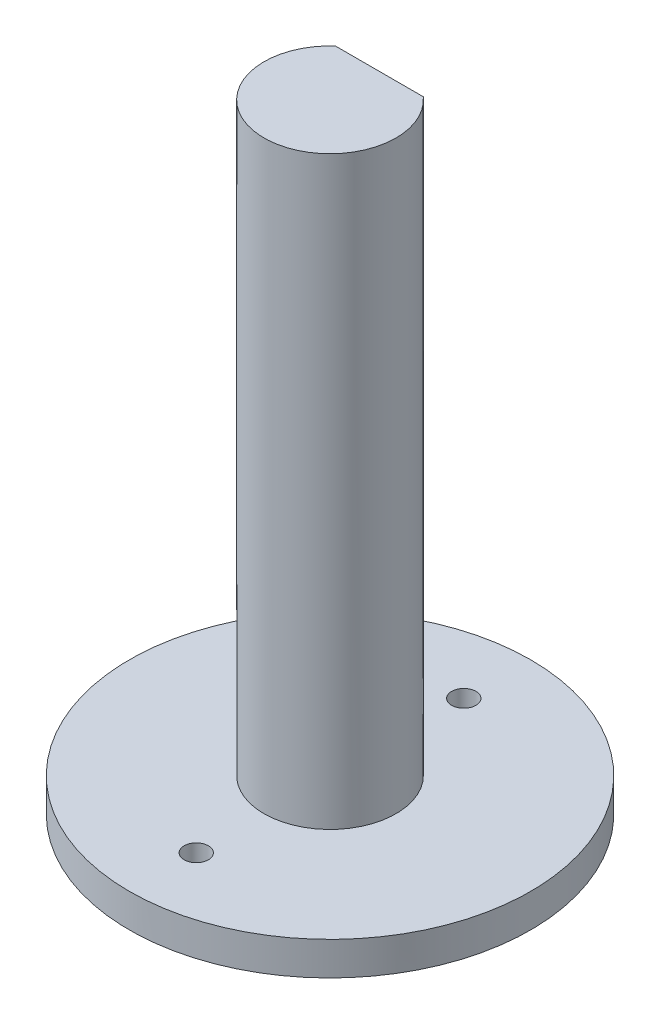
from build123d import *

# Parameters (mm, degrees)
CROQUIS3_R                 = 12
SALIENTE_EXTRUIR1_DEPTH    = 4
CROQUIS4_R                 = 3.95
SALIENTE_EXTRUIR2_DEPTH    = 35
CORTAR_EXTRUIR1_START      = -20
CORTAR_EXTRUIR1_DEPTH      = 20
CROQUIS7_R                 = 12
CORTAR_EXTRUIR2_DEPTH      = 2
CORTAR_EXTRUIR3_DEPTH      = 41.706264874
CORTAR_EXTRUIR3_DEPTH_BACK = 41.706264874
CROQUIS8_R                 = 0.726366889


with BuildPart() as part:
    # Croquis3 → Saliente-Extruir1 (new body)
    with BuildSketch(Plane(origin=(0, 0, 0), x_dir=(1, 0, 0), z_dir=(0, 1, 0))):
        with Locations(Location((0, 0, 0), (0, 0, 270))):
            Circle(CROQUIS3_R)
    extrude(amount=SALIENTE_EXTRUIR1_DEPTH)

    # Croquis4 → Saliente-Extruir2 (add)
    with BuildSketch(Plane(origin=(0, 4, 0), x_dir=(1, 0, 0), z_dir=(0, 1, 0))):
        with Locations(Location((0, 0, 0), (0, 0, 270))):
            Circle(CROQUIS4_R)
    extrude(amount=SALIENTE_EXTRUIR2_DEPTH)

    # Croquis5 → Cortar-Extruir1 (cut)
    with BuildSketch(Plane(origin=(0, 39, 0), x_dir=(1, 0, 0), z_dir=(0, 1, 0)).offset(CORTAR_EXTRUIR1_START)):
        with BuildLine():
            Line((2.626785107, 2.95), (-2.626785107, 2.95))
            ThreePointArc((-2.626785107, 2.95), (0, 3.95), (2.626785107, 2.95))
        make_face()
    extrude(amount=CORTAR_EXTRUIR1_DEPTH, mode=Mode.SUBTRACT)

    # Croquis7 → Cortar-Extruir2 (cut)
    with BuildSketch(Plane.XZ):
        with Locations(Location((0, 0, 0), (0, 0, 270))):
            Circle(CROQUIS7_R)
    extrude(amount=-CORTAR_EXTRUIR2_DEPTH, mode=Mode.SUBTRACT)

    # Croquis8 → Cortar-Extruir3 (cut, two sides: drawn at the far end of the back side and taken through both)
    with BuildSketch(Plane.XZ.offset(-2).offset(-CORTAR_EXTRUIR3_DEPTH_BACK)):
        with Locations(Location((0, 8, 0), (0, 0, 270))):
            Circle(CROQUIS8_R)
        with Locations(Location((0, -8, 0), (0, 0, 270))):
            Circle(CROQUIS8_R)
    extrude(amount=CORTAR_EXTRUIR3_DEPTH + CORTAR_EXTRUIR3_DEPTH_BACK, mode=Mode.SUBTRACT)


solid = part.part
